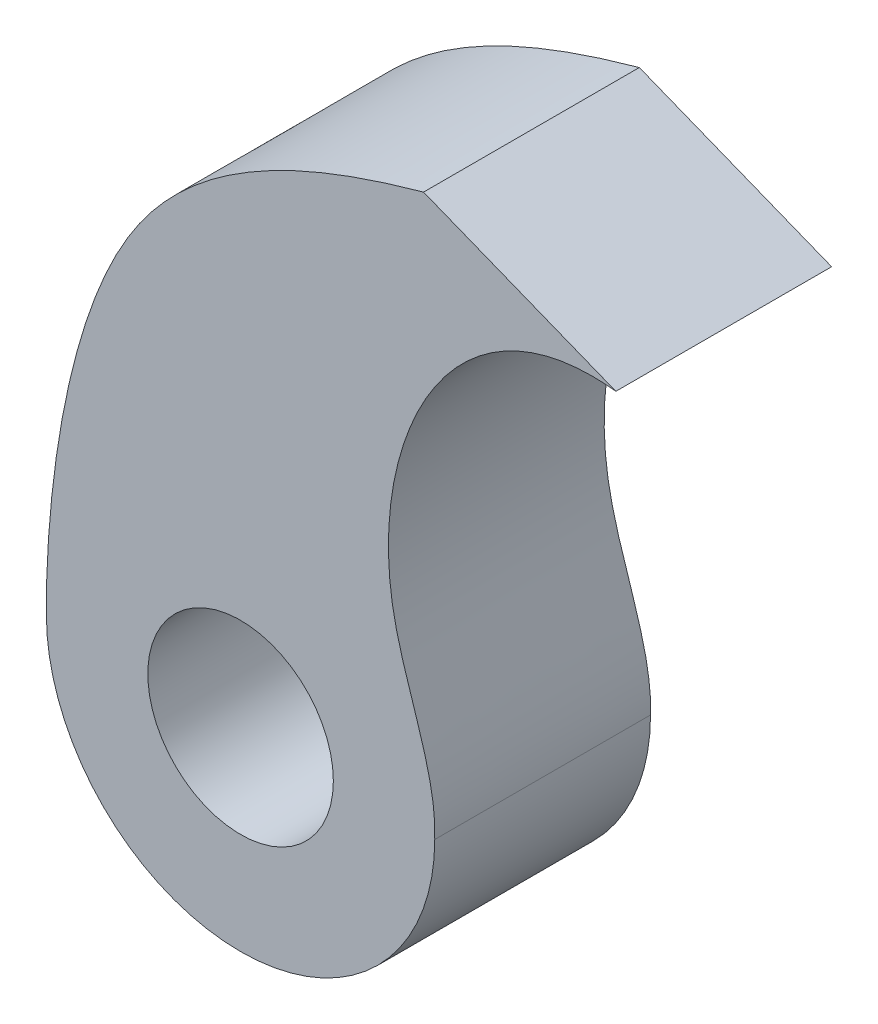
from build123d import *

# Parameters (mm, degrees)
SKETCH1_R           = 4.3
BOSS_EXTRUDE1_DEPTH = 10


with BuildPart() as part:
    # Sketch1 → Boss-Extrude1 (new body)
    with BuildSketch(Plane.XY):
        with BuildLine():
            Line((-8.786321272, 52.647017374), (-17.697634828, 56.188182479))
            add(Edge.make_bspline(
                [(-35.179619379, 30.460455257), (-35.223518874, 33.917669849), (-34.201169153, 49.781165774), (-23.152962073, 54.671871571), (-17.697634828, 56.188182479)],
                knots=[0, 0, 0, 0, 0.555505608, 1, 1, 1, 1], degree=3))
            ThreePointArc((-35.179619379, 30.460455257), (-26.179619379, 21.460455257), (-17.179619379, 30.460455257))
            add(Edge.make_bspline(
                [(-17.179619379, 30.460455257), (-17.07332671, 33.217532109), (-22.036687674, 41.830328863), (-16.393122833, 53.508799667), (-8.786321272, 52.647017374)],
                knots=[0, 0, 0, 0, 0.305227292, 1, 1, 1, 1], degree=3))
        make_face()
        with Locations((-26.179619379, 30.460455257)):
            Circle(SKETCH1_R, mode=Mode.SUBTRACT)
    extrude(amount=BOSS_EXTRUDE1_DEPTH)


solid = part.part
